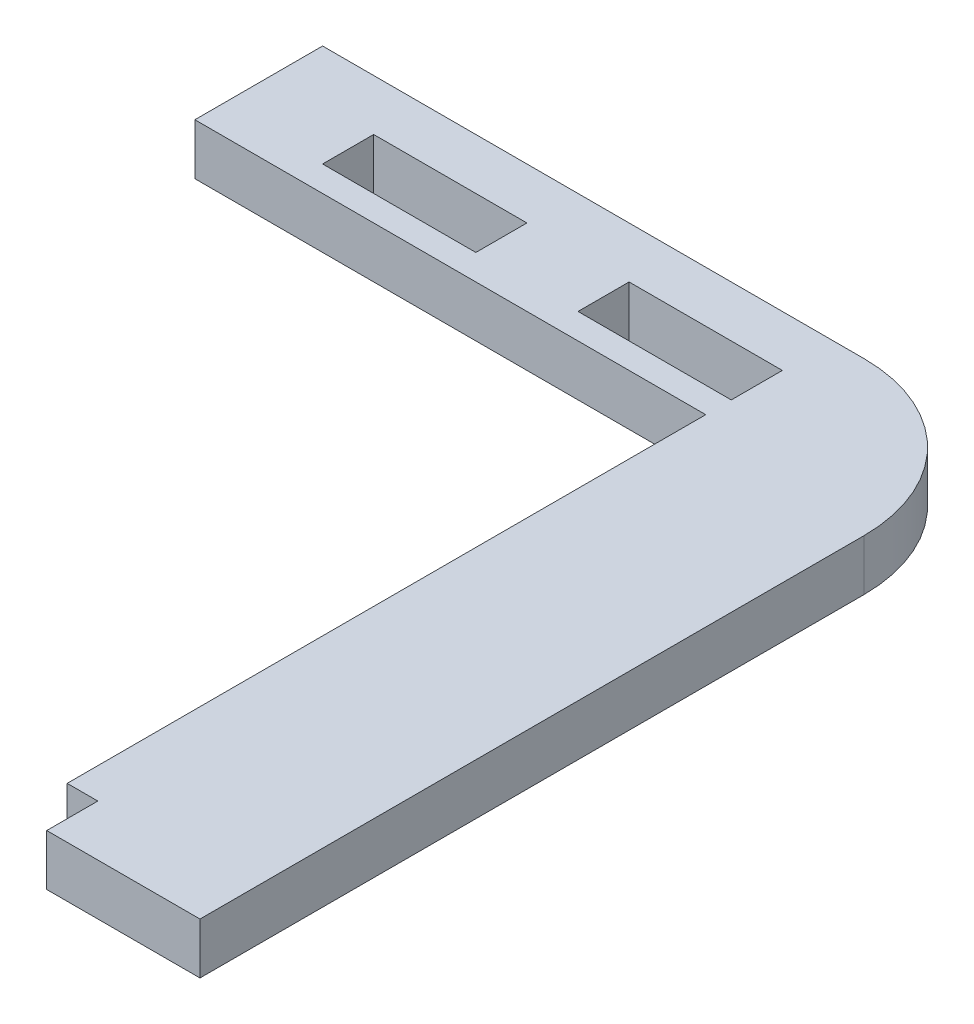
from build123d import *

# Parameters (mm, degrees)
SKETCH1_W           = 15
SKETCH1_H           = 5
BOSS_EXTRUDE1_DEPTH = 5
FILLET3_R           = 15


with BuildPart() as part:
    # Sketch1 → Boss-Extrude1 (new body)
    with BuildSketch(Plane(origin=(0, 0, 0), x_dir=(1, 0, 0), z_dir=(0, 1, 0))):
        Polygon((-34, -25), (-37, -25), (-37, 37.5), (-87, 37.5), (-87, 50), (-19, 50), (-19, -30), (-34, -30), align=None)
        with Locations((-69.5, 42.5)):
            Rectangle(SKETCH1_W, SKETCH1_H, mode=Mode.SUBTRACT)
        with Locations((-44.5, 42.5)):
            Rectangle(SKETCH1_W, SKETCH1_H, mode=Mode.SUBTRACT)
    extrude(amount=BOSS_EXTRUDE1_DEPTH)

    # Fillet3
    fillet3_edges = [part.edges().sort_by_distance(p)[0] for p in [
        (-19, 2.5, -50),
    ]]
    fillet(fillet3_edges, radius=FILLET3_R)


solid = part.part
